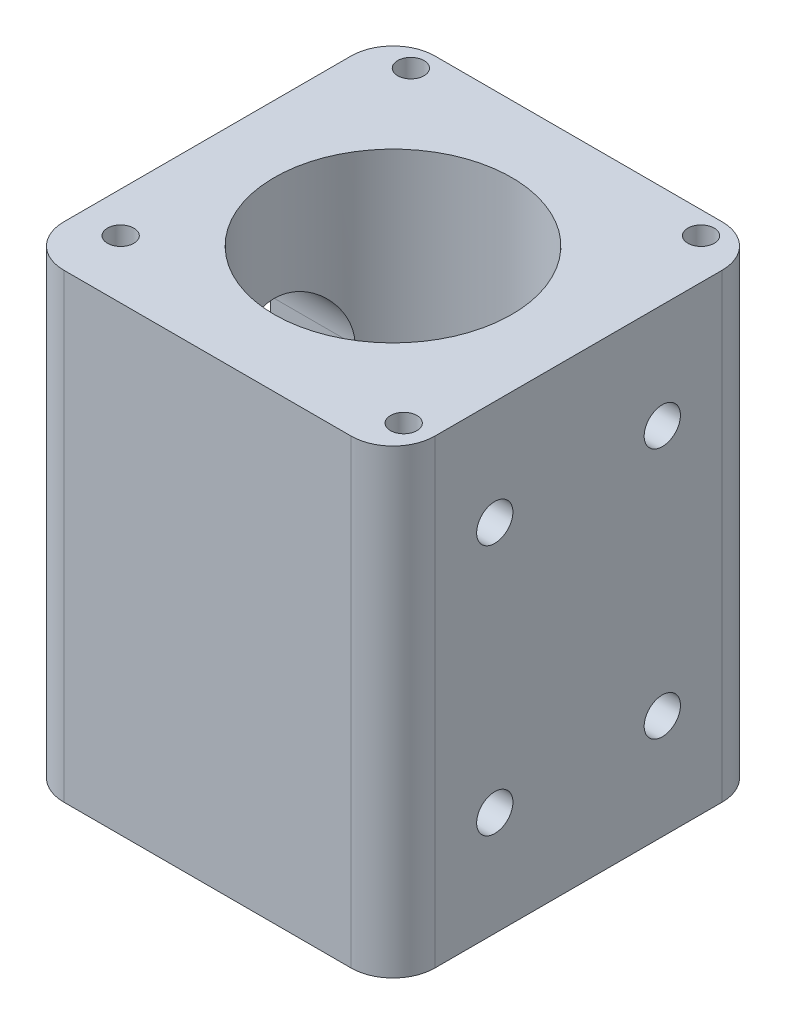
from build123d import *

# Parameters (mm, degrees)
SKETCH1_W        = 56.261
SKETCH1_H        = 56.261
EXTRUSION1_DEPTH = 69.85
HOLE1_D          = 4
HOLE1_DEPTH      = 25.4
HOLE1_TIP        = 1.201721238
SKETCH4_R        = 18
EXTRUSION2_DEPTH = 254
HOLE2_D          = 5
HOLE2_DEPTH      = 25.4
HOLE2_TIP        = 1.502151548
EXTRUSION3_START = -34.925
SKETCH7_R        = 19.0754
SKETCH7_R_2      = 18
EXTRUSION3_DEPTH = 34.925
FILLET1_R        = 6.35
FILLET2_R        = 6.35
FILLET3_R        = 6.35
FILLET4_R        = 6.35
EXTRUSION4_DEPTH = 25.4
HOLE3_D          = 5.5
HOLE3_DEPTH      = 25.4
HOLE3_TIP        = 1.652366702


with BuildPart() as part:
    # Sketch1 → Extrusion1 (new body)
    with BuildSketch(Plane(origin=(0, 0, 0), x_dir=(-1, 0, 0), z_dir=(0, 1, 0))):
        Rectangle(SKETCH1_W, SKETCH1_H)
    extrude(amount=EXTRUSION1_DEPTH)

    # Hole1
    with Locations(Plane(origin=(0, 69.85, 0), x_dir=(1, 0, 0), z_dir=(0, 1, 0))):
        with Locations((-22, 24.70912), (22, 24.70912), (24.058881555, -22.43328), (-22, -19.29088)):
            Hole(HOLE1_D / 2, depth=HOLE1_DEPTH)
            with Locations((0, 0, -(HOLE1_DEPTH + HOLE1_TIP / 2))):  # 118° drill point
                Cone(0, HOLE1_D / 2, HOLE1_TIP, mode=Mode.SUBTRACT)

    # Sketch4 → Extrusion2 (cut)
    with BuildSketch(Plane(origin=(0, 69.85, 0), x_dir=(-1, 0, 0), z_dir=(0, 1, 0))):
        with Locations(Location((0, 0, 0), (0, 0, 90))):
            Circle(SKETCH4_R)
    extrude(amount=-EXTRUSION2_DEPTH, mode=Mode.SUBTRACT)

    # Hole2
    with Locations(Plane(origin=(0, 0, 0), x_dir=(-1, 0, 0), z_dir=(0, -1, 0))):
        with Locations((23.344553846, -23.5712), (-23.797846154, -23.5712), (-23.797846154, 23.5712), (23.344553846, 23.5712)):
            Hole(HOLE2_D / 2, depth=HOLE2_DEPTH)
            with Locations((0, 0, -(HOLE2_DEPTH + HOLE2_TIP / 2))):  # 118° drill point
                Cone(0, HOLE2_D / 2, HOLE2_TIP, mode=Mode.SUBTRACT)

    # Sketch7 → Extrusion3 (cut)
    with BuildSketch(Plane.XZ.offset(EXTRUSION3_START)):
        Circle(SKETCH7_R)
        with Locations(Location((0, 0, 0), (0, 0, 90))):
            Circle(SKETCH7_R_2, mode=Mode.SUBTRACT)
    extrude(amount=EXTRUSION3_DEPTH, mode=Mode.SUBTRACT)

    # Fillet1
    fillet1_edges = [part.edges().sort_by_distance(p)[0] for p in [
        (28.1305, 34.925, 28.1305),
    ]]
    fillet(fillet1_edges, radius=FILLET1_R)

    # Fillet2
    fillet2_edges = [part.edges().sort_by_distance(p)[0] for p in [
        (-28.1305, 34.925, 28.1305),
    ]]
    fillet(fillet2_edges, radius=FILLET2_R)

    # Fillet3
    fillet3_edges = [part.edges().sort_by_distance(p)[0] for p in [
        (28.1305, 34.925, -28.1305),
    ]]
    fillet(fillet3_edges, radius=FILLET3_R)

    # Fillet4
    fillet4_edges = [part.edges().sort_by_distance(p)[0] for p in [
        (-28.1305, 34.925, -28.1305),
    ]]
    fillet(fillet4_edges, radius=FILLET4_R)

    # Sketch8 → Extrusion4 (cut)
    with BuildSketch(Plane.ZY.offset(28.1305)):
        with BuildLine():
            Line((-9.525, 25.4), (-9.525, 44.45))
            ThreePointArc((-9.525, 44.45), (0, 53.975), (9.525, 44.45))
            Line((9.525, 44.45), (9.525, 25.4))
            ThreePointArc((9.525, 25.4), (0, 15.875), (-9.525, 25.4))
        make_face()
    extrude(amount=-EXTRUSION4_DEPTH, mode=Mode.SUBTRACT)

    # Hole3
    with Locations(Plane(origin=(28.1305, 0, 0), x_dir=(0, 0, -1), z_dir=(1, 0, 0))):
        with Locations((-12.7, 53.975), (12.7, 53.975), (12.7, 15.875), (-12.7, 15.875)):
            Hole(HOLE3_D / 2, depth=HOLE3_DEPTH)
            with Locations((0, 0, -(HOLE3_DEPTH + HOLE3_TIP / 2))):  # 118° drill point
                Cone(0, HOLE3_D / 2, HOLE3_TIP, mode=Mode.SUBTRACT)


solid = part.part
